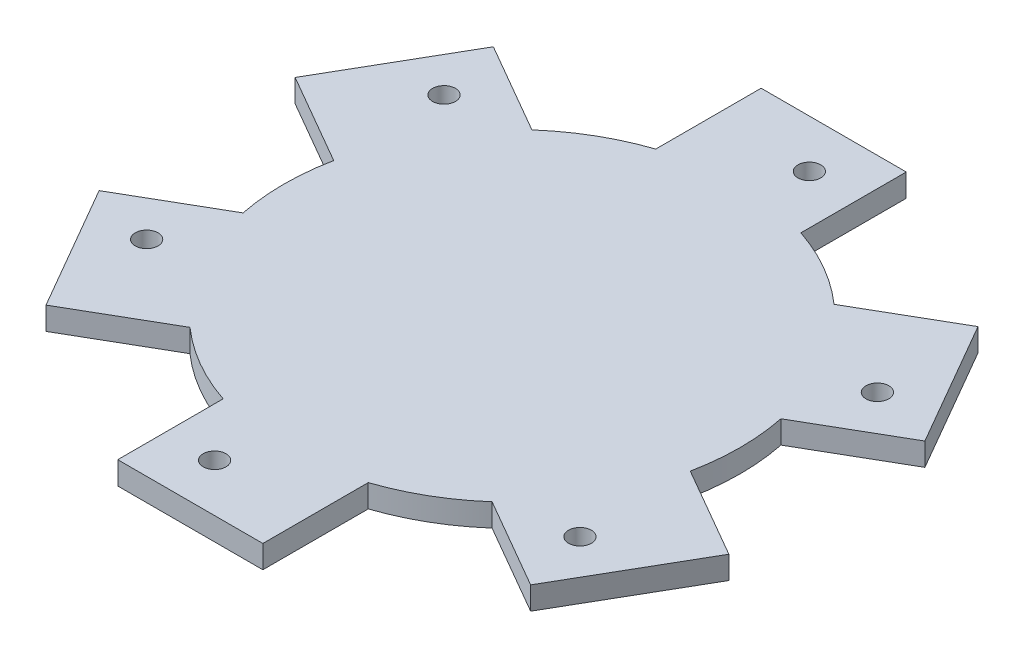
from build123d import *

# Parameters (mm, degrees)
BOSS_EXTRUDE1_DEPTH = 5
CIRPATTERN1_COUNT   = 3
CIRPATTERN1_ANGLE   = 120
SKETCH2_R           = 2.5
CUT_EXTRUDE1_DEPTH  = 99.777078193
CIRPATTERN2_COUNT   = 6


with BuildPart() as part:
    # Sketch1 → Boss-Extrude1 (new body)
    with BuildSketch(Plane(origin=(0, 0, 0), x_dir=(1, 0, 0), z_dir=(0, 1, 0))):
        with BuildLine():
            ThreePointArc((-15.9, 47.404535648), (-50, 0), (-15.9, -47.404535648))
            Line((-15.9, -47.404535648), (-15.9, 47.404535648))
        make_face()
        with BuildLine():
            ThreePointArc((-15.9, -47.404535648), (0, -50), (15.9, -47.404535648))
            Line((15.9, -47.404535648), (15.9, 47.404535648))
            ThreePointArc((15.9, 47.404535648), (0, 50), (-15.9, 47.404535648))
            Line((-15.9, 47.404535648), (-15.9, -47.404535648))
        make_face()
        with BuildLine():
            Line((-15.9, -70.5), (15.9, -70.5))
            Line((15.9, -70.5), (15.9, -47.404535648))
            ThreePointArc((15.9, -47.404535648), (0, -50), (-15.9, -47.404535648))
            Line((-15.9, -47.404535648), (-15.9, -70.5))
        make_face()
        with BuildLine():
            ThreePointArc((-15.9, 47.404535648), (0, 50), (15.9, 47.404535648))
            Line((15.9, 47.404535648), (15.9, 70.5))
            Line((15.9, 70.5), (-15.9, 70.5))
            Line((-15.9, 70.5), (-15.9, 47.404535648))
        make_face()
        with BuildLine():
            Line((15.9, 47.404535648), (15.9, -47.404535648))
            ThreePointArc((15.9, -47.404535648), (40.589407485, -29.197602641), (50, 0))
            ThreePointArc((50, 0), (40.589407485, 29.197602641), (15.9, 47.404535648))
        make_face()
    boss_extrude1 = extrude(amount=BOSS_EXTRUDE1_DEPTH)

    # CirPattern1: Boss-Extrude1 ×3 about axis
    cirpattern1_axis = Axis((0, 0, 0), (0, 1, 0))
    for i in range(1, CIRPATTERN1_COUNT):
        add(boss_extrude1.rotate(cirpattern1_axis, i * CIRPATTERN1_ANGLE / (CIRPATTERN1_COUNT - 1)))

    # Sketch2 → Cut-Extrude1 (cut, through all)
    with BuildSketch(Plane(origin=(0, 5, 0), x_dir=(1, 0, 0), z_dir=(0, 1, 0))):
        with Locations(Location((49.376524227, -34.477351338, 0), (0, 0, 270))):
            Circle(SKETCH2_R)
    cut_extrude1 = extrude(amount=-CUT_EXTRUDE1_DEPTH, mode=Mode.SUBTRACT)

    # CirPattern2: Cut-Extrude1 ×6 about axis
    cirpattern2_axis = Axis((0, 0, 0), (0, 1, 0))
    for i in range(1, CIRPATTERN2_COUNT):
        add(cut_extrude1.rotate(cirpattern2_axis, i * 360 / CIRPATTERN2_COUNT), mode=Mode.SUBTRACT)


solid = part.part
